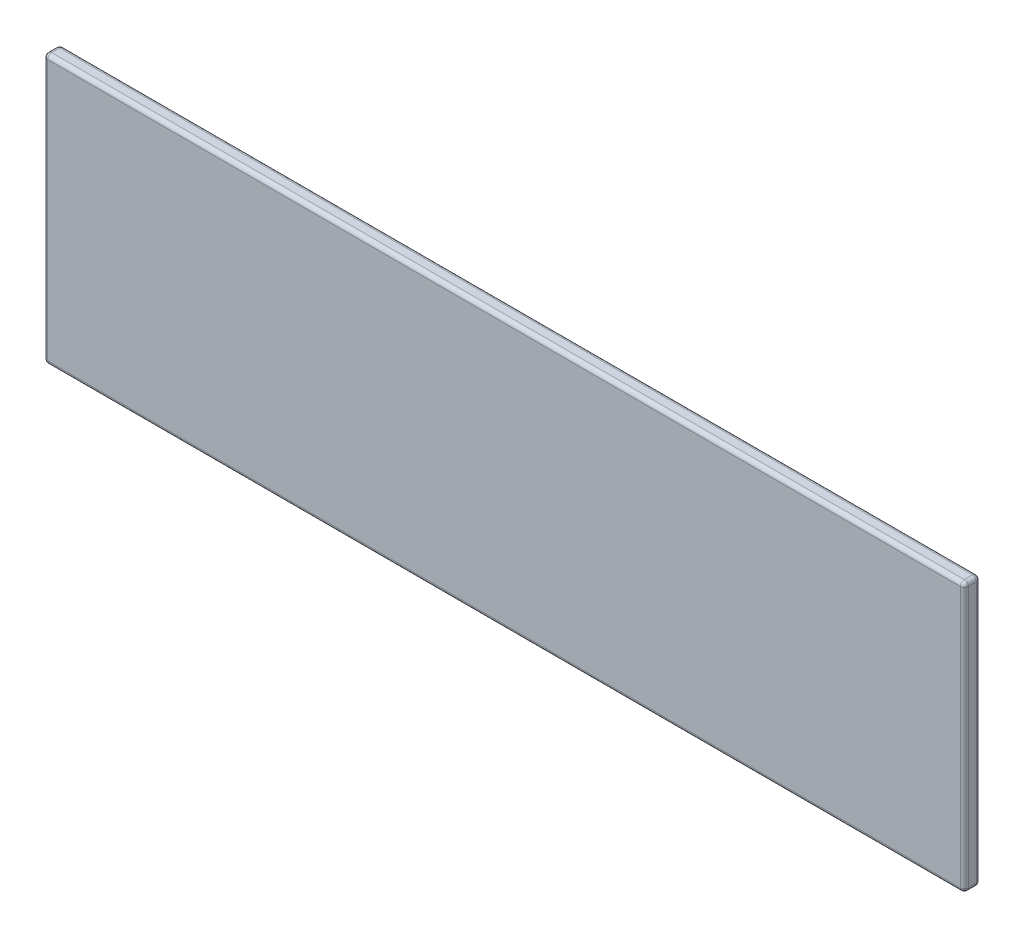
from build123d import *

# Parameters (mm, degrees)
SKETCH1_W           = 114.7
SKETCH1_H           = 33.5
BOSS_EXTRUDE1_DEPTH = 2
FILLET1_R           = 0.5


with BuildPart() as part:
    # Sketch1 → Boss-Extrude1 (new body)
    with BuildSketch(Plane.XY):
        Rectangle(SKETCH1_W, SKETCH1_H)
    extrude(amount=BOSS_EXTRUDE1_DEPTH)

    # Fillet1
    fillet1_edges = [part.edges().sort_by_distance(p)[0] for p in [
        (-57.35, 0, 2),
        (0, -16.75, 2),
        (57.35, 0, 2),
        (0, -16.75, 0),
        (-57.35, 0, 0),
        (0, 16.75, 0),
        (57.35, 0, 0),
        (57.35, -16.75, 1),
        (-57.35, -16.75, 1),
        (-57.35, 16.75, 1),
        (57.35, 16.75, 1),
        (0, 16.75, 2),
    ]]
    fillet(fillet1_edges, radius=FILLET1_R)


solid = part.part
